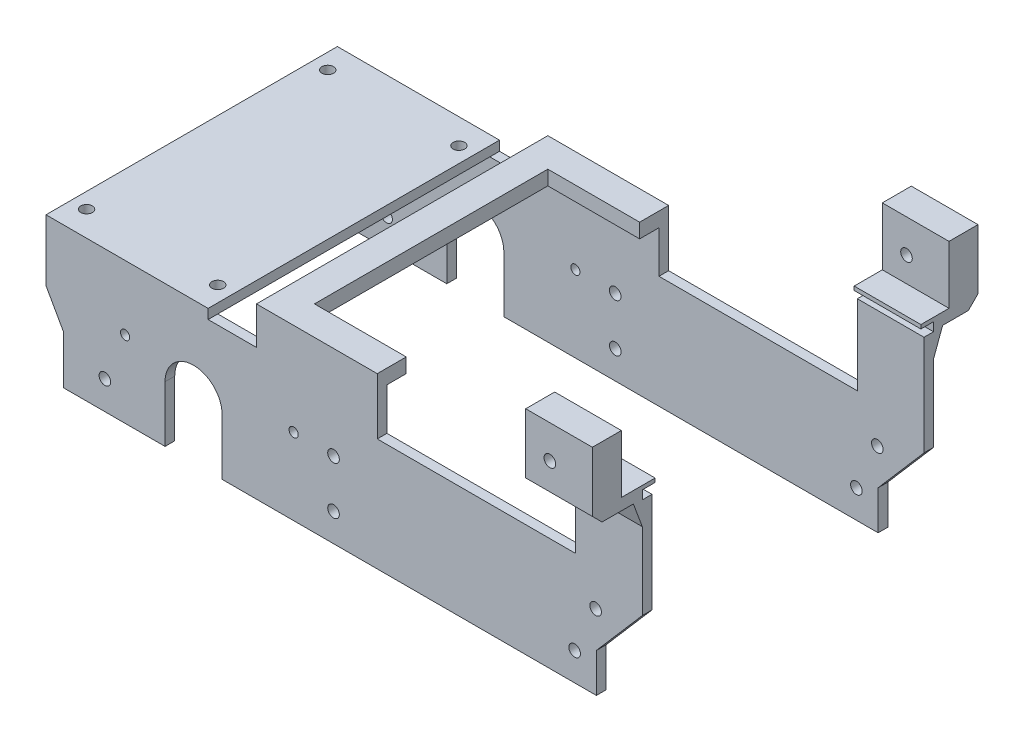
from build123d import *

# Parameters (mm, degrees)
EXTRUDE_1_DEPTH     = 2
SKETCH_3_R          = 1.2
SKETCH_3_R_2        = 0.95
CUT_EXTRUDE_1_DEPTH = 2
SKETCH_4_W          = 56.3
SKETCH_4_H          = 2
EXTRUDE_2_DEPTH     = 13.8
SKETCH_5_R          = 1.2
SKETCH_5_R_2        = 0.95
SKETCH_5_W          = 13.8
SKETCH_5_H          = 5
SKETCH_5_H_2        = 2
EXTRUDE_3_DEPTH     = 2
SKETCH_6_W          = 43.55
SKETCH_6_H          = 2
CUT_EXTRUDE_2_DEPTH = 7.8
SKETCH_7_W          = 41.05
SKETCH_7_H          = 2
CUT_EXTRUDE_3_DEPTH = 3.9
EXTRUDE_4_DEPTH     = 13.8
SKETCH_9_W          = 25
SKETCH_9_H          = 3
EXTRUDE_5_DEPTH     = 56.3
SKETCH_10_W         = 33.55
SKETCH_10_H         = 56.3
SKETCH_10_H_2       = 2
EXTRUDE_6_DEPTH     = 2
SKETCH_11_W         = 56.3
SKETCH_11_H         = 2
CUT_EXTRUDE_4_DEPTH = 13.8
SKETCH_12_R         = 1.2
CUT_EXTRUDE_5_DEPTH = 166.991357908
SKETCH_16_R         = 1.2
CUT_EXTRUDE_6_DEPTH = 173.653387316
CHAMFER_1_SIZE      = 2
SKETCH_17_W         = 19
SKETCH_17_H         = 48.3
CUT_EXTRUDE_7_DEPTH = 10


with BuildPart() as part:
    # 草图2 → 凸台-拉伸1 (new body)
    with BuildSketch(Plane.XY):
        with BuildLine():
            Line((-24.5, 4.256503127), (-24.5, 20.182093825))
            Line((-24.5, 20.182093825), (-38.3, 20.182093825))
            Line((-38.3, 20.182093825), (-38.3, 12.382093825))
            Line((-38.3, 12.382093825), (-79.35, 12.382093825))
            Line((-79.35, 12.382093825), (-79.35, 20.182093825))
            Line((-79.35, 20.182093825), (-147.9, 20.182093825))
            Line((-147.9, 20.182093825), (-147.9, 1.662240991))
            Line((-147.9, 1.662240991), (-144.261, -4.817906175))
            Line((-144.261, -4.817906175), (-144.261, -14.817906175))
            Line((-144.261, -14.817906175), (-123.261, -14.817906175))
            Line((-123.261, -14.817906175), (-123.261, -3.217906175))
            ThreePointArc((-123.261, -3.217906175), (-117.3555, 2.687593825), (-111.45, -3.217906175))
            Line((-111.45, -3.217906175), (-111.45, -14.817906175))
            Line((-111.45, -14.817906175), (-34, -14.817906175))
            Line((-34, -14.817906175), (-34, -6.743496873))
            Line((-34, -6.743496873), (-24.5, 4.256503127))
        make_face()
    extrude(amount=-EXTRUDE_1_DEPTH)

    # 草图3 → 切除-拉伸1 (cut)
    with BuildSketch(Plane.XY):
        with Locations((-135.711, -8.917906175)):
            Circle(SKETCH_3_R)
        with Locations((-131.53, 1.032093825)):
            Circle(SKETCH_3_R_2)
        with Locations((-96.65, 1.032093825)):
            Circle(SKETCH_3_R_2)
        with BuildLine():
            ThreePointArc((-89.591805353, 1.032093825), (-89.296660471, 0.094597744), (-88.4, -0.307906175))
            ThreePointArc((-88.4, -0.307906175), (-87.551471863, 0.043565688), (-87.2, 0.892093825))
            ThreePointArc((-87.2, 0.892093825), (-87.202050413, 0.962213637), (-87.208194647, 1.032093825))
            Line((-87.208194647, 1.032093825), (-89.591805353, 1.032093825))
        make_face()
        with BuildLine():
            Line((-89.591805353, 1.032093825), (-87.208194647, 1.032093825))
            ThreePointArc((-87.208194647, 1.032093825), (-88.4, 2.092093825), (-89.591805353, 1.032093825))
        make_face()
        with BuildLine():
            ThreePointArc((-88.4, -10.207906175), (-87.551471863, -9.856434312), (-87.2, -9.007906175))
            ThreePointArc((-87.2, -9.007906175), (-87.551471863, -8.159378037), (-88.4, -7.807906175))
            Line((-88.4, -7.807906175), (-88.4, -10.207906175))
        make_face()
        with BuildLine():
            ThreePointArc((-88.4, -7.807906175), (-89.6, -9.007906175), (-88.4, -10.207906175))
            Line((-88.4, -10.207906175), (-88.4, -7.807906175))
        make_face()
        with BuildLine():
            ThreePointArc((-35.294856819, 1.032093825), (-35.136729236, -0.055043177), (-34.16, -0.557906175))
            ThreePointArc((-34.16, -0.557906175), (-33.311471863, -0.206434312), (-32.96, 0.642093825))
            ThreePointArc((-32.96, 0.642093825), (-32.976397832, 0.839795389), (-33.025143181, 1.032093825))
            Line((-33.025143181, 1.032093825), (-35.294856819, 1.032093825))
        make_face()
        with BuildLine():
            ThreePointArc((-33.025143181, 1.032093825), (-34.16, 1.842093825), (-35.294856819, 1.032093825))
            Line((-35.294856819, 1.032093825), (-33.025143181, 1.032093825))
        make_face()
        with BuildLine():
            ThreePointArc((-39.7, -9.007906175), (-39.348528137, -9.856434312), (-38.5, -10.207906175))
            ThreePointArc((-38.5, -10.207906175), (-37.651471863, -9.856434312), (-37.3, -9.007906175))
            Line((-37.3, -9.007906175), (-39.7, -9.007906175))
        make_face()
        with BuildLine():
            Line((-39.7, -9.007906175), (-37.3, -9.007906175))
            ThreePointArc((-37.3, -9.007906175), (-38.5, -7.807906175), (-39.7, -9.007906175))
        make_face()
    extrude(amount=-CUT_EXTRUDE_1_DEPTH, mode=Mode.SUBTRACT)

    # 草图4 → 凸台-拉伸2 (add)
    with BuildSketch(Plane.ZY.offset(38.3)):
        with Locations((-30.15, 14.182093825)):
            Rectangle(SKETCH_4_W, SKETCH_4_H)
    extrude(amount=-EXTRUDE_2_DEPTH)

    # 草图5 → 凸台-拉伸3 (add)
    # profile 1 of 3: a face of its own
    with BuildSketch(Plane(origin=(0, 0, -58.3), x_dir=(-1, 0, 0), z_dir=(0, 0, -1))):
        with BuildLine():
            ThreePointArc((123.261, -3.217906175), (117.3555, 2.687593825), (111.45, -3.217906175))
            Line((111.45, -3.217906175), (111.45, -14.817906175))
            Line((111.45, -14.817906175), (34, -14.817906175))
            Line((34, -14.817906175), (34, -6.743496873))
            Line((34, -6.743496873), (24.5, 4.256503127))
            Line((24.5, 4.256503127), (24.5, 13.182093825))
            Line((24.5, 13.182093825), (38.3, 13.182093825))
            Line((38.3, 13.182093825), (38.3, 12.382093825))
            Line((38.3, 12.382093825), (79.35, 12.382093825))
            Line((79.35, 12.382093825), (79.35, 20.182093825))
            Line((79.35, 20.182093825), (147.9, 20.182093825))
            Line((147.9, 20.182093825), (147.9, 1.662240991))
            Line((147.9, 1.662240991), (144.261, -4.817906175))
            Line((144.261, -4.817906175), (144.261, -14.817906175))
            Line((144.261, -14.817906175), (123.261, -14.817906175))
            Line((123.261, -14.817906175), (123.261, -3.217906175))
        make_face()
        with Locations(Location((135.711, -8.917906175, 0), (0, 0, 180))):
            Circle(SKETCH_5_R, mode=Mode.SUBTRACT)
        with Locations(Location((131.53, 1.032093825, 0), (0, 0, 180))):
            Circle(SKETCH_5_R_2, mode=Mode.SUBTRACT)
        with Locations(Location((96.65, 1.032093825, 0), (0, 0, 180))):
            Circle(SKETCH_5_R_2, mode=Mode.SUBTRACT)
        with Locations(Location((88.4, -9.007906175, 0), (0, 0, 180))):
            Circle(SKETCH_5_R, mode=Mode.SUBTRACT)
        with Locations(Location((88.4, 0.892093825, 0), (0, 0, 180))):
            Circle(SKETCH_5_R, mode=Mode.SUBTRACT)
        with Locations(Location((38.5, -9.007906175, 0), (0, 0, 180))):
            Circle(SKETCH_5_R, mode=Mode.SUBTRACT)
        with Locations(Location((34.16, 0.642093825, 0), (0, 0, 180))):
            Circle(SKETCH_5_R, mode=Mode.SUBTRACT)
    # profile 2 of 3: a face of its own
    with BuildSketch(Plane(origin=(0, 0, -58.3), x_dir=(-1, 0, 0), z_dir=(0, 0, -1))):
        with Locations((31.4, 17.682093825)):
            Rectangle(SKETCH_5_W, SKETCH_5_H)
    # profile 3 of 3: a face of its own
    with BuildSketch(Plane(origin=(0, 0, -58.3), x_dir=(-1, 0, 0), z_dir=(0, 0, -1))):
        with Locations((31.4, 14.182093825)):
            Rectangle(SKETCH_5_W, SKETCH_5_H_2)
    extrude(amount=EXTRUDE_3_DEPTH)

    # 草图6 → 切除-拉伸2 (cut)
    with BuildSketch(Plane(origin=(0, 20.182093825, 0), x_dir=(1, 0, 0), z_dir=(0, 1, 0))):
        with Locations((-126.125, 1)):
            Rectangle(SKETCH_6_W, SKETCH_6_H)
        with Locations((-126.125, 59.3)):
            Rectangle(SKETCH_6_W, SKETCH_6_H)
    extrude(amount=-CUT_EXTRUDE_2_DEPTH, mode=Mode.SUBTRACT)

    # 草图7 → 切除-拉伸3 (cut)
    with BuildSketch(Plane(origin=(0, 12.382093825, 0), x_dir=(1, 0, 0), z_dir=(0, 1, 0))):
        with Locations((-58.825, 1)):
            Rectangle(SKETCH_7_W, SKETCH_7_H)
        with Locations((-58.825, 59.3)):
            Rectangle(SKETCH_7_W, SKETCH_7_H)
    extrude(amount=-CUT_EXTRUDE_3_DEPTH, mode=Mode.SUBTRACT)

    # 草图8 → 凸台-拉伸4 (add)
    with BuildSketch(Plane.ZY.offset(38.3)):
        Polygon((-62.15, 25.182093825), (-60.3, 20.182093825), (-58.3, 20.182093825), (-58.3, 24.982093825), (-60.27, 24.982093825), (-60.27, 26.782093825), (-57.65, 26.782093825), (-57.65, 27.582093825), (-63.47, 27.582093825), (-63.47, 39.582093825), (-69.47, 39.582093825), (-69.47, 25.182093825), align=None)
        Polygon((-2, 24.982093825), (-2, 20.182093825), (0, 20.182093825), (1.85, 25.182093825), (10.33, 25.182093825), (10.33, 39.582093825), (4.33, 39.582093825), (4.33, 27.582093825), (-2.65, 27.582093825), (-2.65, 26.782093825), (-0.03, 26.782093825), (-0.03, 24.982093825), align=None)
    extrude(amount=-EXTRUDE_4_DEPTH)

    # 草图9 → 凸台-拉伸5 (add)
    with BuildSketch(Plane.XY.offset(-58.3)):
        with Locations((-91.85, 18.682093825)):
            Rectangle(SKETCH_9_W, SKETCH_9_H)
    extrude(amount=EXTRUDE_5_DEPTH)

    # 草图10 → 凸台-拉伸6 (add)
    with BuildSketch(Plane(origin=(0, 12.382093825, 0), x_dir=(1, 0, 0), z_dir=(0, 1, 0))):
        with Locations((-131.125, 30.15)):
            Rectangle(SKETCH_10_W, SKETCH_10_H)
        with Locations((-131.125, 1)):
            Rectangle(SKETCH_10_W, SKETCH_10_H_2)
        with Locations((-131.125, 59.3)):
            Rectangle(SKETCH_10_W, SKETCH_10_H_2)
    extrude(amount=EXTRUDE_6_DEPTH)

    # 草图11 → 切除-拉伸4 (cut)
    with BuildSketch(Plane.ZY.offset(38.3)):
        with Locations((-30.15, 14.182093825)):
            Rectangle(SKETCH_11_W, SKETCH_11_H)
    extrude(amount=-CUT_EXTRUDE_4_DEPTH, mode=Mode.SUBTRACT)

    # 草图12 → 切除-拉伸5 (cut, through all)
    with BuildSketch(Plane(origin=(0, 14.382093825, 0), x_dir=(1, 0, 0), z_dir=(0, 1, 0))):
        with Locations(Location((-117.55, 5.2, 0), (0, 0, 180))):
            Circle(SKETCH_12_R)
        with Locations(Location((-117.55, 55.1, 0), (0, 0, 180))):
            Circle(SKETCH_12_R)
        with Locations(Location((-144.7, 55.1, 0), (0, 0, 180))):
            Circle(SKETCH_12_R)
        with Locations(Location((-144.7, 5.2, 0), (0, 0, 180))):
            Circle(SKETCH_12_R)
    extrude(amount=-CUT_EXTRUDE_5_DEPTH, mode=Mode.SUBTRACT)

    # 草图16 → 切除-拉伸6 (cut, through all)
    with BuildSketch(Plane.XY.offset(10.33)):
        with Locations((-33.3, 32.732093825)):
            Circle(SKETCH_16_R)
    extrude(amount=-CUT_EXTRUDE_6_DEPTH, mode=Mode.SUBTRACT)

    # 倒角1
    chamfer_1_edges = [part.edges().sort_by_distance(p)[0] for p in [
        (-31.4, 25.182093825, -69.47),
        (-31.4, 25.182093825, 10.33),
    ]]
    chamfer(chamfer_1_edges, length=CHAMFER_1_SIZE)

    # 草图17 → 切除-拉伸7 (cut)
    with BuildSketch(Plane(origin=(0, 20.182093825, 0), x_dir=(1, 0, 0), z_dir=(0, 1, 0))):
        with Locations((-88.85, 30.15)):
            Rectangle(SKETCH_17_W, SKETCH_17_H)
    extrude(amount=-CUT_EXTRUDE_7_DEPTH, mode=Mode.SUBTRACT)


solid = part.part
